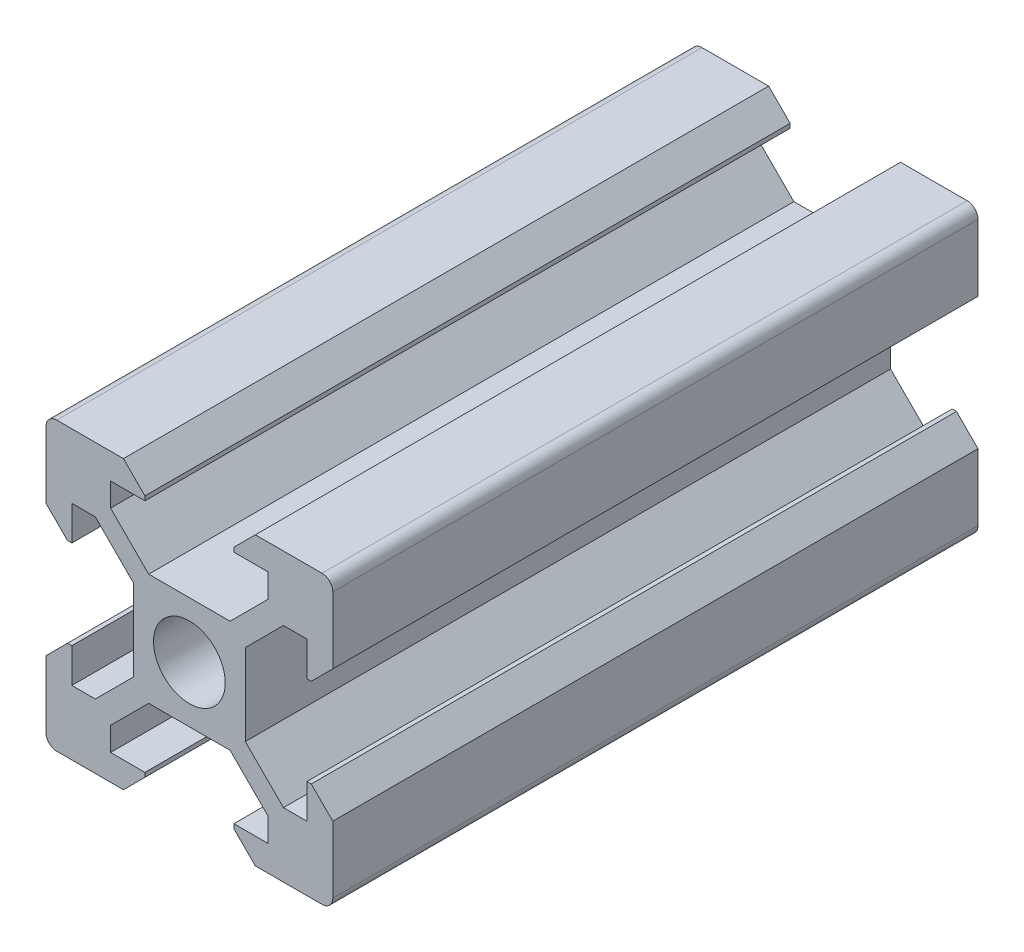
from build123d import *

# Parameters (mm, degrees)
CROQUIS1_R              = 2.5
SALIENTE_EXTRUIR1_DEPTH = 480
CUT_EXTRUDE1_DEPTH      = 25
CUT_EXTRUDE1_DEPTH_BACK = 24
SKETCH2_W               = 600
SKETCH2_H               = 26.97008712
CUT_EXTRUDE4_DEPTH      = 21
CUT_EXTRUDE4_DEPTH_BACK = 41
SKETCH4_W               = 140
SKETCH4_H               = 71.605139047


with BuildPart() as part:
    # Croquis1 → Saliente-Extruir1 (new body)
    with BuildSketch(Plane.XY):
        with BuildLine():
            Line((-4.6, 10), (-3.1, 8.5))
            Line((-3.1, 8.5), (-3.1, 8.2))
            Line((-3.1, 8.2), (-5.5, 8.2))
            Line((-5.5, 8.2), (-5.5, 6.560660172))
            Line((-5.5, 6.560660172), (-2.84, 3.900660172))
            Line((-2.84, 3.900660172), (0, 3.900660172))
            Line((0, 3.900660172), (2.84, 3.900660172))
            Line((2.84, 3.900660172), (5.5, 6.560660172))
            Line((5.5, 6.560660172), (5.5, 8.2))
            Line((5.5, 8.2), (3.1, 8.2))
            Line((3.1, 8.2), (3.1, 8.5))
            Line((3.1, 8.5), (4.6, 10))
            Line((4.6, 10), (9.25, 10))
            ThreePointArc((9.25, 10), (9.780330086, 9.780330086), (10, 9.25))
            Line((10, 9.25), (10, 4.6))
            Line((10, 4.6), (8.5, 3.1))
            Line((8.5, 3.1), (8.2, 3.1))
            Line((8.2, 3.1), (8.2, 5.5))
            Line((8.2, 5.5), (6.560660172, 5.5))
            Line((6.560660172, 5.5), (3.900660172, 2.84))
            Line((3.900660172, 2.84), (3.900660172, 0))
            Line((3.900660172, 0), (3.900660172, -2.84))
            Line((3.900660172, -2.84), (6.560660172, -5.5))
            Line((6.560660172, -5.5), (8.2, -5.5))
            Line((8.2, -5.5), (8.2, -3.1))
            Line((8.2, -3.1), (8.5, -3.1))
            Line((8.5, -3.1), (10, -4.6))
            Line((10, -4.6), (10, -9.25))
            ThreePointArc((10, -9.25), (9.780330086, -9.780330086), (9.25, -10))
            Line((9.25, -10), (4.6, -10))
            Line((4.6, -10), (3.1, -8.5))
            Line((3.1, -8.5), (3.1, -8.2))
            Line((3.1, -8.2), (5.5, -8.2))
            Line((5.5, -8.2), (5.5, -6.560660172))
            Line((5.5, -6.560660172), (2.84, -3.900660172))
            Line((2.84, -3.900660172), (0, -3.900660172))
            Line((0, -3.900660172), (-2.84, -3.900660172))
            Line((-2.84, -3.900660172), (-5.5, -6.560660172))
            Line((-5.5, -6.560660172), (-5.5, -8.2))
            Line((-5.5, -8.2), (-3.1, -8.2))
            Line((-3.1, -8.2), (-3.1, -8.5))
            Line((-3.1, -8.5), (-4.6, -10))
            Line((-4.6, -10), (-9.25, -10))
            ThreePointArc((-9.25, -10), (-9.780330086, -9.780330086), (-10, -9.25))
            Line((-10, -9.25), (-10, -4.6))
            Line((-10, -4.6), (-8.5, -3.1))
            Line((-8.5, -3.1), (-8.2, -3.1))
            Line((-8.2, -3.1), (-8.2, -5.5))
            Line((-8.2, -5.5), (-6.560660172, -5.5))
            Line((-6.560660172, -5.5), (-3.900660172, -2.84))
            Line((-3.900660172, -2.84), (-3.900660172, 0))
            Line((-3.900660172, 0), (-3.900660172, 2.84))
            Line((-3.900660172, 2.84), (-6.560660172, 5.5))
            Line((-6.560660172, 5.5), (-8.2, 5.5))
            Line((-8.2, 5.5), (-8.2, 3.1))
            Line((-8.2, 3.1), (-8.5, 3.1))
            Line((-8.5, 3.1), (-10, 4.6))
            Line((-10, 4.6), (-10, 9.25))
            ThreePointArc((-10, 9.25), (-9.780330086, 9.780330086), (-9.25, 10))
            Line((-9.25, 10), (-4.6, 10))
        make_face()
        Circle(CROQUIS1_R, mode=Mode.SUBTRACT)
    extrude(amount=SALIENTE_EXTRUIR1_DEPTH)

    # Sketch2 → Cut-Extrude1 (cut, two sides: drawn at the far end of the back side and taken through both)
    with BuildSketch(Plane(origin=(0, 0, 0), x_dir=(0, 0, -1), z_dir=(1, 0, 0)).offset(-CUT_EXTRUDE1_DEPTH_BACK)):
        Rectangle(SKETCH2_W, SKETCH2_H)
    extrude(amount=CUT_EXTRUDE1_DEPTH + CUT_EXTRUDE1_DEPTH_BACK, mode=Mode.SUBTRACT)

    # Sketch4 → Cut-Extrude4 (cut, two sides: drawn at the far end of the back side and taken through both)
    with BuildSketch(Plane(origin=(0, 0, 0), x_dir=(0, 0, -1), z_dir=(1, 0, 0)).offset(-CUT_EXTRUDE4_DEPTH_BACK)):
        with Locations((-365, -0.774109611)):
            Rectangle(SKETCH4_W, SKETCH4_H)
    extrude(amount=CUT_EXTRUDE4_DEPTH + CUT_EXTRUDE4_DEPTH_BACK, mode=Mode.SUBTRACT)


solid = part.part
